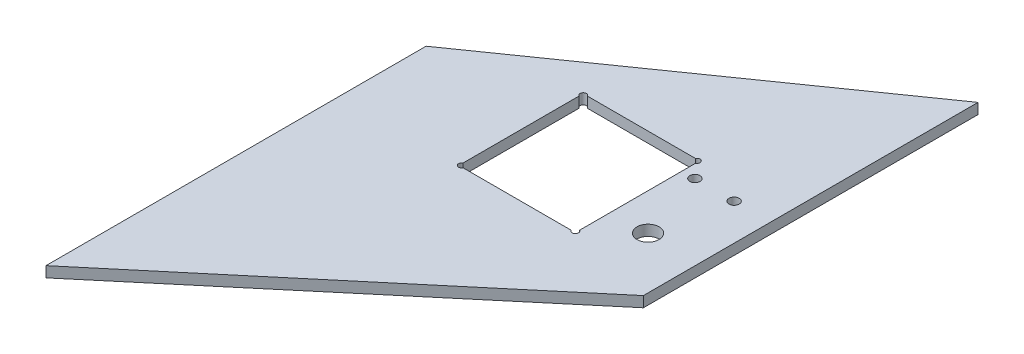
from build123d import *

# Parameters (mm, degrees)
BOSS_EXTRUDE1_DEPTH         = 2.54
BOSS_EXTRUDE1_DEPTH_BACK    = 1.27
SKETCH1_R                   = 3.96875
SKETCH1_R_2                 = 1.8288
SKETCH1_W                   = 41.843046883
SKETCH1_H                   = 42.037
SKETCH2_W                   = 41.843046883
SKETCH2_H                   = 1.3462
SKETCH2_H_2                 = 1.27
CUT_EXTRUDE1_DEPTH          = 239.72059927
F_43_0_089_DIAMETER_HOLE1_D = 2.2606


with BuildPart() as part:
    # Sketch1 → Boss-Extrude1 (new, two sides: drawn at the far end of the back side and taken through both)
    with BuildSketch(Plane(origin=(0, 0, 0), x_dir=(1, 0, 0), z_dir=(0, 1, 0)).offset(-BOSS_EXTRUDE1_DEPTH_BACK)):
        Polygon((0, -9.930453132), (0, 126.604027306), (116.61929014, 208.261733362), (116.61929014, 88.059530464), align=None)
        with Locations(Location((98.042383887, 108.299920281, 0), (0, 0, 270))):
            Circle(SKETCH1_R, mode=Mode.SUBTRACT)
        with Locations(Location((89.458607167, 133.716920501, 0), (0, 0, 270))):
            Circle(SKETCH1_R_2, mode=Mode.SUBTRACT)
        with Locations(Location((103.545290714, 133.716920501, 0), (0, 0, 270))):
            Circle(SKETCH1_R_2, mode=Mode.SUBTRACT)
        with Locations((63.903769784, 117.780411398)):
            Rectangle(SKETCH1_W, SKETCH1_H, mode=Mode.SUBTRACT)
    extrude(amount=BOSS_EXTRUDE1_DEPTH + BOSS_EXTRUDE1_DEPTH_BACK)

    # Sketch2 → Cut-Extrude1 (cut, through all)
    with BuildSketch(Plane(origin=(0, 2.54, 0), x_dir=(1, 0, 0), z_dir=(0, 1, 0))):
        with Locations((63.903769784, 96.088811398)):
            Rectangle(SKETCH2_W, SKETCH2_H)
        with Locations((63.903769784, 139.433911398)):
            Rectangle(SKETCH2_W, SKETCH2_H_2)
    extrude(amount=-CUT_EXTRUDE1_DEPTH, mode=Mode.SUBTRACT)

    # #43 (0.089) Diameter Hole1 (through all)
    with Locations(Plane(origin=(0, 2.54, 0), x_dir=(1, 0, 0), z_dir=(0, 1, 0))):
        with Locations((84.317293225, 95.923711398), (84.317293225, 139.560911398), (43.490246342, 95.923711398), (43.490246342, 139.560911398)):
            Hole(F_43_0_089_DIAMETER_HOLE1_D / 2)


solid = part.part
